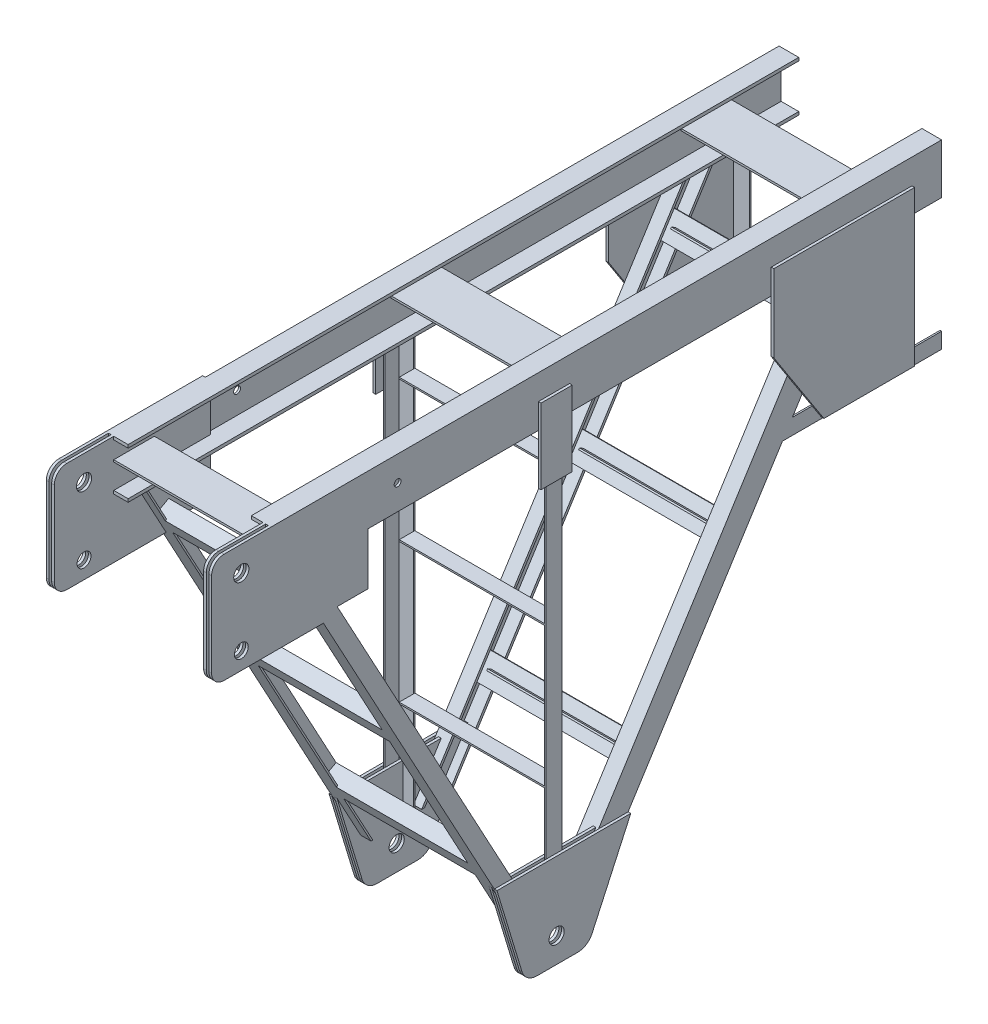
from build123d import *

# Parameters (mm, degrees)
EXTRUDE_1_DEPTH               = 2335
EXTRUDE_1_2_DEPTH             = 2335
EXTRUDE_3_DEPTH               = 511.5
SKETCH_11_R                   = 24.25
CUT_EXTRUDE_10_DEPTH          = 2398.545620004
PATTERN_LINEAR_1_COUNT        = 3
PATTERN_LINEAR_1_PITCH        = 927.5
EXTRUDE_11_DEPTH              = 50
PATTERN_LINEAR_2_COUNT        = 2
PATTERN_LINEAR_2_PITCH        = 470
CUT_EXTRUDE_12_DEPTH          = 45
CUT_EXTRUDE_13_DEPTH          = 7
CUT_EXTRUDE_14_DEPTH          = 38
CUT_EXTRUDE_15_DEPTH          = 45
CUT_EXTRUDE_16_DEPTH          = 2
CUT_EXTRUDE_17_DEPTH          = 42.7
SKETCH_21_W                   = 50
SKETCH_21_H                   = 50
EXTRUDE_18_DEPTH              = 470
PATTERN_LINEAR_3_COUNT        = 3
PATTERN_LINEAR_3_PITCH        = 450
SKETCH_25_W                   = 510
SKETCH_25_H                   = 45
CUT_EXTRUDE_19_DEPTH          = 45
EXTRUDE_20_DEPTH              = 520
PATTERN_LINEAR_4_COUNT        = 3
PATTERN_LINEAR_4_PITCH        = 575
SKETCH_27_W                   = 510
SKETCH_27_H                   = 45
CUT_EXTRUDE_21_DEPTH          = 45
EXTRUDE_22_DEPTH              = 520
SKETCH_30_W                   = 429
SKETCH_30_H                   = 5
EXTRUDE_23_DEPTH              = 15
PATTERN_LINEAR_5_COUNT        = 3
PATTERN_LINEAR_5_PITCH        = 550
EXTRUDE_24_DEPTH              = 8.5
PATTERN_LINEAR_6_COUNT        = 2
PATTERN_LINEAR_6_PITCH        = 17
PATTERN_LINEAR_7_COUNT        = 2
PATTERN_LINEAR_7_PITCH        = 511.5
PATTERN_LINEAR_7_COPY_1_DEPTH = 8.5
SKETCH_33_W                   = 8.5
SKETCH_33_H                   = 400
CUT_EXTRUDE_26_DEPTH          = 160
FILLET_1_R                    = 50
SKETCH_35_R                   = 24.25
CUT_EXTRUDE_27_DEPTH          = 2827.763874115
SKETCH_36_W                   = 486
SKETCH_36_H                   = 500
CUT_EXTRUDE_28_DEPTH          = 160
SKETCH_37_W                   = 503
SKETCH_37_H                   = 160
CUT_EXTRUDE_29_DEPTH          = 190
EXTRUDE_30_DEPTH              = 2
PATTERN_LINEAR_8_COUNT        = 2
PATTERN_LINEAR_8_PITCH        = 505
EXTRUDE_31_DEPTH              = 8.5
PATTERN_LINEAR_9_COUNT        = 2
PATTERN_LINEAR_9_PITCH        = 17
SKETCH_40_R                   = 24.25
CUT_EXTRUDE_32_DEPTH          = 2827.763874115
SKETCH_41_W                   = 8.5
SKETCH_41_H                   = 160
CUT_EXTRUDE_33_DEPTH          = 190
SKETCH_42_W                   = 100
SKETCH_42_H                   = 140
EXTRUDE_34_DEPTH              = 2
SKETCH_48_W                   = 50
SKETCH_48_H                   = 370
EXTRUDE_40_DEPTH              = 520
CUT_EXTRUDE_41_DEPTH          = 370
EXTRUDE_42_DEPTH              = 50
PATTERN_LINEAR_10_COUNT       = 2
PATTERN_LINEAR_10_PITCH       = 470
SKETCH_51_W                   = 140
SKETCH_51_H                   = 45
CUT_EXTRUDE_43_DEPTH          = 45
SKETCH_52_W                   = 140
SKETCH_52_H                   = 45
CUT_EXTRUDE_44_DEPTH          = 45
EXTRUDE_45_DEPTH              = 428.5
EXTRUDE_46_DEPTH              = 8.5
PATTERN_LINEAR_11_COUNT       = 2
PATTERN_LINEAR_11_PITCH       = 528.5
SKETCH_57_W                   = 100
SKETCH_57_H                   = 240
EXTRUDE_48_DEPTH              = 8.5
PATTERN_LINEAR_12_COUNT       = 2
PATTERN_LINEAR_12_PITCH       = 528.5
PATTERN_LINEAR_13_COUNT       = 2
PATTERN_LINEAR_13_PITCH       = 520
PATTERN_LINEAR_14_COUNT       = 2
PATTERN_LINEAR_14_PITCH       = 503
SKETCH_58_R                   = 24.25
SKETCH_58_R_2                 = 22.25
CUT_EXTRUDE_49_DEPTH          = 2826.161455563
FILLET_2_R                    = 40
SKETCH_59_R                   = 11
CUT_EXTRUDE_50_DEPTH          = 2826.161455563


with BuildPart() as part:
    # 草图2 → 拉伸1 (new body)
    with BuildSketch(Plane.XY):
        Polygon((0, 0), (0, 160), (63, 160), (63, 150), (6.5, 150), (6.5, 10), (63, 10), (63, 0), align=None)
    extrude(amount=EXTRUDE_1_DEPTH)

    # 草图5 → 拉伸3 (add)
    with BuildSketch(Plane.ZY):
        Polygon((160, 95), (320, 95), (320, 88.5), (243.25, 88.5), (243.25, 48.5), (236.75, 48.5), (236.75, 88.5), (160, 88.5), align=None)
    extrude_3 = extrude(amount=-EXTRUDE_3_DEPTH)


with BuildPart() as body_2:
    # 草图2 → Extrude 1 2 (new body)
    with BuildSketch(Plane.XY):
        Polygon((457, 160), (520, 160), (520, 0), (457, 0), (457, 10), (513.5, 10), (513.5, 150), (457, 150), align=None)
    extrude(amount=EXTRUDE_1_2_DEPTH)


with BuildPart() as cut_extrude_10_tool:
    # 草图11 → 拉伸10 (new, through all)
    with BuildSketch(Plane.ZY):
        with Locations((2240, 80)):
            Circle(SKETCH_11_R)
    extrude(amount=-CUT_EXTRUDE_10_DEPTH)


with BuildPart() as part_1:
    add(part.part)

    # 拉伸10: cut by cut_extrude_10_tool
    add(cut_extrude_10_tool.part, mode=Mode.SUBTRACT)

    # 阵列(线性)1: 拉伸3 ×3
    with Locations(*[(0, 0, i * PATTERN_LINEAR_1_PITCH) for i in range(1, PATTERN_LINEAR_1_COUNT)]):
        add(extrude_3)

    # 草图12 → 拉伸11 (add)
    with BuildSketch(Plane.ZY):
        Polygon((243.294523914, 0), (1192.661612522, -1500), (1268.42568906, -1500), (2080.134549819, 0), (2023.2831717, 0), (1265, -1401.271826065), (1265, 0), (1215, 0), (1215, -1385.705347785), (337.97129887, 0), align=None)
    extrude_11 = extrude(amount=-EXTRUDE_11_DEPTH)

    # 草图15 → 拉伸12 (cut)
    with BuildSketch(Plane(origin=(50, 0, 0), x_dir=(0, 0, -1), z_dir=(1, 0, 0))):
        Polygon((-1265, 0), (-1220, 0), (-1220, -1500), (-1262.740551248, -1500), (-2074.449412007, 0), (-2023.2831717, 0), (-1265, -1401.271826065), align=None)
    extrude(amount=-CUT_EXTRUDE_12_DEPTH, mode=Mode.SUBTRACT)

    # 草图16 → 拉伸13 (cut)
    with BuildSketch(Plane(origin=(50, 0, 0), x_dir=(0, 0, -1), z_dir=(1, 0, 0))):
        Polygon((-337.97129887, 0), (-243.294523914, 0), (-1192.661612522, -1500), (-1215, -1500), (-1215, -1385.705347785), align=None)
    extrude(amount=-CUT_EXTRUDE_13_DEPTH, mode=Mode.SUBTRACT)

    # 草图17 → 拉伸14 (cut)
    with BuildSketch(Plane(origin=(43, 0, 0), x_dir=(0, 0, -1), z_dir=(1, 0, 0))):
        Polygon((-1202.129290018, -1500), (-1215, -1500), (-1215, -1400.664278228), (-328.503621375, 0), (-252.76220141, 0), align=None)
    extrude(amount=-CUT_EXTRUDE_14_DEPTH, mode=Mode.SUBTRACT)


with BuildPart() as body_2_1:
    add(body_2.part)

    # 拉伸10: cut by cut_extrude_10_tool
    add(cut_extrude_10_tool.part, mode=Mode.SUBTRACT)

    # 阵列(线性)2: 拉伸11 ×2
    with Locations(*[(i * PATTERN_LINEAR_2_PITCH, 0, 0) for i in range(1, PATTERN_LINEAR_2_COUNT)]):
        add(extrude_11)

    # 草图18 → 拉伸15 (cut)
    with BuildSketch(Plane.ZY.offset(-470)):
        Polygon((2074.449412007, 0), (2023.2831717, 0), (1265, -1401.271826065), (1265, 0), (1220, 0), (1220, -1500), (1262.740551248, -1500), align=None)
    extrude(amount=-CUT_EXTRUDE_15_DEPTH, mode=Mode.SUBTRACT)

    # 草图19 → 拉伸16 (cut)
    with BuildSketch(Plane.ZY.offset(-470)):
        Polygon((252.76220141, 0), (328.503621375, 0), (1215, -1400.664278228), (1215, -1500), (1202.129290018, -1500), align=None)
    extrude(amount=-CUT_EXTRUDE_16_DEPTH, mode=Mode.SUBTRACT)

    # 草图20 → 拉伸17 (cut)
    with BuildSketch(Plane.ZY.offset(-472)):
        Polygon((253.353931253, 0), (327.911891531, 0), (1215, -1401.59921138), (1215, -1500), (1202.721019861, -1500), align=None)
    extrude(amount=-CUT_EXTRUDE_17_DEPTH, mode=Mode.SUBTRACT)

    # 草图21 → 拉伸18 (add)
    with BuildSketch(Plane(origin=(520, 0, 0), x_dir=(0, 0, -1), z_dir=(1, 0, 0))):
        with Locations((-1240, -125)):
            Rectangle(SKETCH_21_W, SKETCH_21_H)
    extrude_18 = extrude(amount=-EXTRUDE_18_DEPTH)


with BuildPart() as part_2:
    add(part_1.part)

    add(body_2_1.part)  # 阵列(线性)3 merges body 2
    # 阵列(线性)3: 拉伸18 ×3
    with Locations(*[(0, -i * PATTERN_LINEAR_3_PITCH, 0) for i in range(1, PATTERN_LINEAR_3_COUNT)]):
        add(extrude_18)

    # 草图25 → 拉伸19 (cut)
    with BuildSketch(Plane.XY.offset(1265)):
        with Locations((260, -127.5)):
            Rectangle(SKETCH_25_W, SKETCH_25_H)
        with Locations((260, -577.5)):
            Rectangle(SKETCH_25_W, SKETCH_25_H)
        with Locations((260, -1027.5)):
            Rectangle(SKETCH_25_W, SKETCH_25_H)
    extrude(amount=-CUT_EXTRUDE_19_DEPTH, mode=Mode.SUBTRACT)

    # 草图26 → 拉伸20 (add)
    with BuildSketch(Plane(origin=(520, 0, 0), x_dir=(0, 0, -1), z_dir=(1, 0, 0))):
        Polygon((-1969.169247649, -100), (-2013.143555445, -123.796223522), (-1989.347331923, -167.770531318), (-1945.373024127, -143.974307795), align=None)
    extrude_20 = extrude(amount=-EXTRUDE_20_DEPTH)

    # 阵列(线性)4: 拉伸20 ×3
    with Locations(*[Vector(0, -0.8794861559075059, -0.4759244704436181) * (i * PATTERN_LINEAR_4_PITCH) for i in range(1, PATTERN_LINEAR_4_COUNT)]):
        add(extrude_20)

    # 草图27 → 拉伸21 (cut)
    with BuildSketch(Plane(origin=(0, -846.883579525, 1565.001234678), x_dir=(-1, 0, 0), z_dir=(0, 0.4759244704436186, -0.8794861559075056))):
        with Locations((-260, 821.727215811)):
            Rectangle(SKETCH_27_W, SKETCH_27_H)
        with Locations((-260, 246.727215811)):
            Rectangle(SKETCH_27_W, SKETCH_27_H)
        with Locations((-260, -328.272784189)):
            Rectangle(SKETCH_27_W, SKETCH_27_H)
    extrude(amount=-CUT_EXTRUDE_21_DEPTH, mode=Mode.SUBTRACT)

    # 草图29 → 拉伸22 (add)
    with BuildSketch(Plane.ZY):
        Polygon((356.88269985, -100), (399.666507318, -167.598415799), (395.441606331, -170.272403766), (352.657798863, -102.673987967), align=None)
    extrude_22 = extrude(amount=-EXTRUDE_22_DEPTH)

    # 草图30 → 拉伸23 (add)
    with BuildSketch(Plane(origin=(0, 132.672081502, 209.621888773), x_dir=(1, 0, 0), z_dir=(0, 0.5347975933477903, 0.8449801974895101))):
        with Locations((259.85, -315.358028736)):
            Rectangle(SKETCH_30_W, SKETCH_30_H)
    extrude_23 = extrude(amount=EXTRUDE_23_DEPTH)

    # 阵列(线性)5: 拉伸22, 拉伸23 ×3
    with Locations(*[Vector(0, -0.8449801974895097, 0.534797593347791) * (i * PATTERN_LINEAR_5_PITCH) for i in range(1, PATTERN_LINEAR_5_COUNT)]):
        add(extrude_22)
        add(extrude_23)

    # 草图31 → 拉伸24 (add)
    with BuildSketch(Plane(origin=(520, 0, 0), x_dir=(0, 0, -1), z_dir=(1, 0, 0))):
        Polygon((-1430.767461211, -1200), (-1002.7881948, -1200), (-1140, -1500), (-1340, -1500), align=None)
    extrude_24 = extrude(amount=EXTRUDE_24_DEPTH)

    # 阵列(线性)6: 拉伸24 ×2
    with Locations(*[(-i * PATTERN_LINEAR_6_PITCH, 0, 0) for i in range(1, PATTERN_LINEAR_6_COUNT)]):
        add(extrude_24)

    # 阵列(线性)7: 拉伸24 ×2
    with Locations(*[(-i * PATTERN_LINEAR_7_PITCH, 0, 0) for i in range(1, PATTERN_LINEAR_7_COUNT)]):
        add(extrude_24)

    # 阵列(线性)7 copy 1 sketch → 阵列(线性)7 copy 1 (add)
    with BuildSketch(Plane(origin=(-8.5, 0, 0), x_dir=(0, 0, -1), z_dir=(1, 0, 0))):
        Polygon((-1430.767461211, -1200), (-1002.7881948, -1200), (-1140, -1500), (-1340, -1500), align=None)
    extrude(amount=PATTERN_LINEAR_7_COPY_1_DEPTH)

    # 草图33 → 拉伸26 (cut)
    with BuildSketch(Plane.XZ.offset(1500)):
        with Locations((515.75, 1241.370275624)):
            Rectangle(SKETCH_33_W, SKETCH_33_H)
        with Locations((4.25, 1241.370275624)):
            Rectangle(SKETCH_33_W, SKETCH_33_H)
    extrude(amount=-CUT_EXTRUDE_26_DEPTH, mode=Mode.SUBTRACT)

    # 圆角1
    fillet_1_edges = [part_2.edges().sort_by_distance(p)[0] for p in [
        (524.25, -1500, 1340),
        (524.25, -1500, 1140),
        (507.25, -1500, 1340),
        (507.25, -1500, 1140),
        (12.75, -1500, 1340),
        (12.75, -1500, 1140),
        (-4.25, -1500, 1340),
        (-4.25, -1500, 1140),
    ]]
    fillet(fillet_1_edges, radius=FILLET_1_R)

    # 草图35 → 拉伸27 (cut, through all)
    with BuildSketch(Plane.ZY.offset(8.5)):
        with Locations((1240, -1420)):
            Circle(SKETCH_35_R)
    extrude(amount=-CUT_EXTRUDE_27_DEPTH, mode=Mode.SUBTRACT)

    # 草图36 → 拉伸28 (cut)
    with BuildSketch(Plane.XZ.offset(1500)):
        with Locations((260, 1222.740551248)):
            Rectangle(SKETCH_36_W, SKETCH_36_H)
    extrude(amount=-CUT_EXTRUDE_28_DEPTH, mode=Mode.SUBTRACT)

    # 草图37 → 拉伸29 (cut)
    with BuildSketch(Plane.XY.offset(2335)):
        with Locations((260, 80)):
            Rectangle(SKETCH_37_W, SKETCH_37_H)
    extrude(amount=-CUT_EXTRUDE_29_DEPTH, mode=Mode.SUBTRACT)

    # 草图38 → 拉伸30 (add)
    with BuildSketch(Plane(origin=(6.5, 0, 0), x_dir=(0, 0, -1), z_dir=(1, 0, 0))):
        Polygon((-2335, 150), (-1935, 150), (-1865, 80), (-1935, 10), (-2335, 10), align=None)
    extrude_30 = extrude(amount=EXTRUDE_30_DEPTH)

    # 阵列(线性)8: 拉伸30 ×2
    with Locations(*[(i * PATTERN_LINEAR_8_PITCH, 0, 0) for i in range(1, PATTERN_LINEAR_8_COUNT)]):
        add(extrude_30)

    # 草图39 → 拉伸31 (add)
    with BuildSketch(Plane.ZY):
        Polygon((1835, -166.203776478), (1933.343786327, -166.203776478), (1977.318094123, -190), (2335, -190), (2335, 160), (1835, 160), align=None)
    extrude_31 = extrude(amount=EXTRUDE_31_DEPTH)

    # 阵列(线性)9: 拉伸31 ×2
    with Locations(*[(i * PATTERN_LINEAR_9_PITCH, 0, 0) for i in range(1, PATTERN_LINEAR_9_COUNT)]):
        add(extrude_31)

    # 草图40 → 拉伸32 (cut, through all)
    with BuildSketch(Plane.ZY.offset(8.5)):
        with Locations((2240, 80)):
            Circle(SKETCH_40_R)
    extrude(amount=-CUT_EXTRUDE_32_DEPTH, mode=Mode.SUBTRACT)

    # 草图41 → 拉伸33 (cut)
    with BuildSketch(Plane.XY.offset(2335)):
        with Locations((4.25, 80)):
            Rectangle(SKETCH_41_W, SKETCH_41_H)
    extrude(amount=-CUT_EXTRUDE_33_DEPTH, mode=Mode.SUBTRACT)

    # 草图42 → 拉伸34 (add)
    with BuildSketch(Plane(origin=(6.5, 0, 0), x_dir=(0, 0, -1), z_dir=(1, 0, 0))):
        with Locations((-1885, 80)):
            Rectangle(SKETCH_42_W, SKETCH_42_H)
    extrude(amount=EXTRUDE_34_DEPTH)



with BuildPart() as body_2_2:
    # 草图48 → 拉伸40 (new body)
    with BuildSketch(Plane.ZY):
        with Locations((120, -185)):
            Rectangle(SKETCH_48_W, SKETCH_48_H)
    extrude(amount=-EXTRUDE_40_DEPTH)

    # 草图49 → 拉伸41 (cut)
    with BuildSketch(Plane.XZ.offset(370)):
        Polygon((5, 95), (5, 140), (50, 140), (50, 145), (470, 145), (470, 140), (515, 140), (515, 95), align=None)
    extrude(amount=-CUT_EXTRUDE_41_DEPTH, mode=Mode.SUBTRACT)


with BuildPart() as cut_extrude_41_piece_1:
    # of the separate pieces the step leaves, piece 1, a body of its own (cut_extrude_41_pieces)
    add(body_2_2.part.solids().sort_by_distance((515, 0, 140))[0])


with BuildPart() as cut_extrude_41_piece_2:
    # of the separate pieces the step leaves, piece 2, a body of its own (cut_extrude_41_pieces)
    add(body_2_2.part.solids().sort_by_distance((0, 0, 95))[0])


with BuildPart() as part_3:
    add(part_2.part)

    add(cut_extrude_41_piece_2.part)  # 拉伸42 merges 拉伸41 piece 2
    # 草图50 → 拉伸42 (add)
    with BuildSketch(Plane.ZY):
        Polygon((0, -370), (477.471739104, -370), (509.117308725, -420), (0, -420), align=None)
    extrude_42 = extrude(amount=-EXTRUDE_42_DEPTH)


    add(cut_extrude_41_piece_1.part)  # 阵列(线性)10 merges 拉伸41 piece 1
    # 阵列(线性)10: 拉伸42 ×2
    with Locations(*[(i * PATTERN_LINEAR_10_PITCH, 0, 0) for i in range(1, PATTERN_LINEAR_10_COUNT)]):
        add(extrude_42)

    # 草图51 → 拉伸43 (cut)
    with BuildSketch(Plane(origin=(50, 0, 0), x_dir=(0, 0, -1), z_dir=(1, 0, 0))):
        with Locations((-70, -392.5)):
            Rectangle(SKETCH_51_W, SKETCH_51_H)
        Polygon((-505.952751763, -415), (-477.471739104, -370), (-145, -370), (-145, -415), align=None)
    extrude(amount=-CUT_EXTRUDE_43_DEPTH, mode=Mode.SUBTRACT)

    # 草图52 → 拉伸44 (cut)
    with BuildSketch(Plane.ZY.offset(-470)):
        with Locations((70, -392.5)):
            Rectangle(SKETCH_52_W, SKETCH_52_H)
        Polygon((145, -370), (145, -415), (505.952751763, -415), (477.471739104, -370), align=None)
    extrude(amount=-CUT_EXTRUDE_44_DEPTH, mode=Mode.SUBTRACT)

    # 草图53 → 拉伸45 (add)
    with BuildSketch(Plane(origin=(50, 0, 0), x_dir=(0, 0, -1), z_dir=(1, 0, 0))):
        Polygon((-145, -370), (-145, -420), (-95, -420), (-95, -415), (-140, -415), (-140, -370), align=None)
    extrude(amount=EXTRUDE_45_DEPTH)

    # 草图55 → 拉伸46 (add)
    with BuildSketch(Plane.ZY):
        Polygon((95, 80), (95, -415), (385, -415), (545, -167.5), (545, 80), align=None)
    extrude_46 = extrude(amount=EXTRUDE_46_DEPTH)

    # 阵列(线性)11: 拉伸46 ×2
    with Locations(*[(i * PATTERN_LINEAR_11_PITCH, 0, 0) for i in range(1, PATTERN_LINEAR_11_COUNT)]):
        add(extrude_46)

    # 草图57 → 拉伸48 (add)
    with BuildSketch(Plane.ZY):
        with Locations((1240, -40)):
            Rectangle(SKETCH_57_W, SKETCH_57_H)
    extrude_48 = extrude(amount=EXTRUDE_48_DEPTH)

    # 阵列(线性)12: 拉伸48 ×2
    with Locations(*[(i * PATTERN_LINEAR_12_PITCH, 0, 0) for i in range(1, PATTERN_LINEAR_12_COUNT)]):
        add(extrude_48)

    # 阵列(线性)13: 拉伸31 ×2
    with Locations(*[(i * PATTERN_LINEAR_13_PITCH, 0, 0) for i in range(1, PATTERN_LINEAR_13_COUNT)]):
        add(extrude_31)

    # 阵列(线性)14: 拉伸31 ×2
    with Locations(*[(i * PATTERN_LINEAR_14_PITCH, 0, 0) for i in range(1, PATTERN_LINEAR_14_COUNT)]):
        add(extrude_31)

    # 草图58 → 拉伸49 (cut, through all)
    with BuildSketch(Plane(origin=(520, 0, 0), x_dir=(0, 0, -1), z_dir=(1, 0, 0))):
        with Locations((-2240, 80)):
            Circle(SKETCH_58_R)
        with Locations((-2240, -135)):
            Circle(SKETCH_58_R_2)
    extrude(amount=-CUT_EXTRUDE_49_DEPTH, mode=Mode.SUBTRACT)

    # 圆角2
    fillet_2_edges = [part_3.edges().sort_by_distance(p)[0] for p in [
        (515.75, 160, 2335),
        (12.75, 160, 2335),
        (12.75, -190, 2335),
        (515.75, -190, 2335),
        (498.75, -190, 2335),
        (498.75, 160, 2335),
        (-4.25, 160, 2335),
        (-4.25, -190, 2335),
    ]]
    fillet(fillet_2_edges, radius=FILLET_2_R)

    # 草图59 → 拉伸50 (cut, through all)
    with BuildSketch(Plane(origin=(520, 0, 0), x_dir=(0, 0, -1), z_dir=(1, 0, 0))):
        with Locations((-1740, 80)):
            Circle(SKETCH_59_R)
    extrude(amount=-CUT_EXTRUDE_50_DEPTH, mode=Mode.SUBTRACT)


solid = part_3.part
